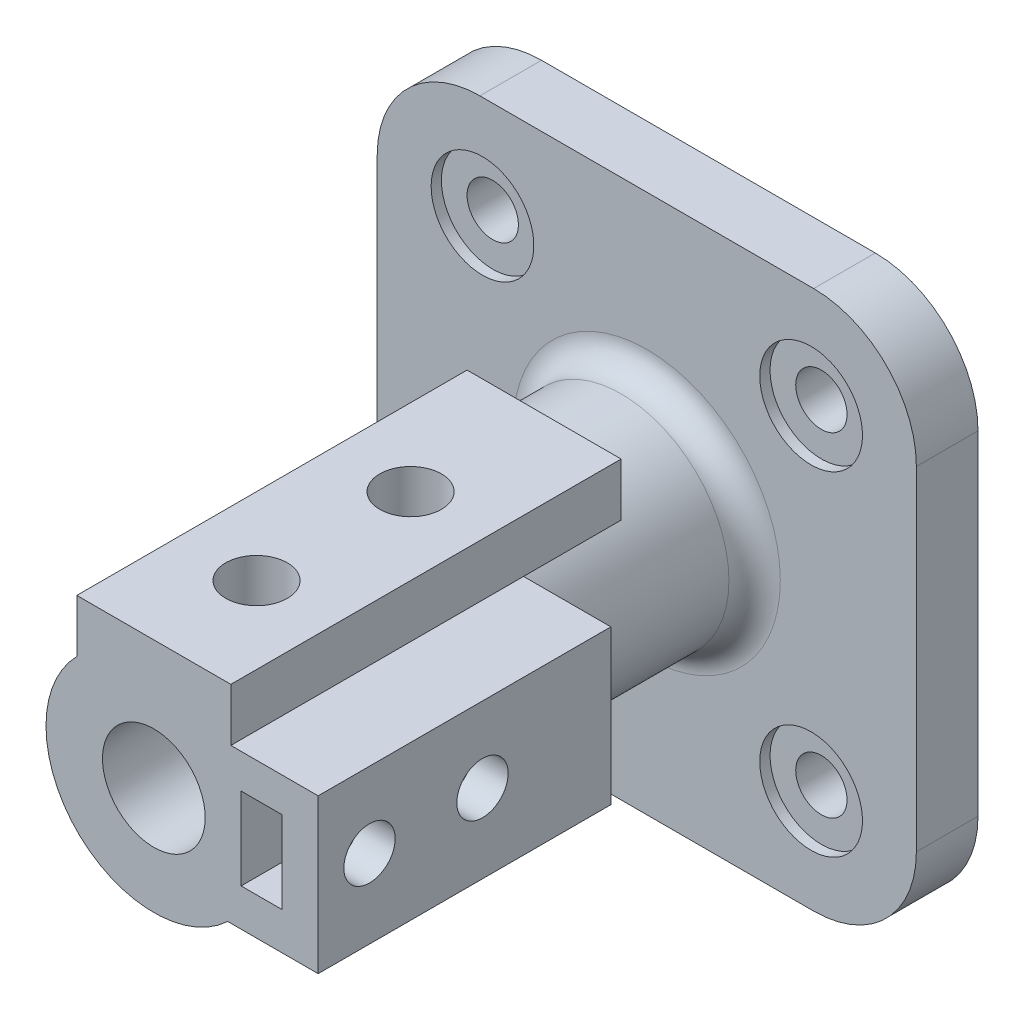
from build123d import *

# Parameters (mm, degrees)
SKETCH1_R           = 21
BOSS_EXTRUDE1_DEPTH = 48
SKETCH2_R           = 5
BOSS_EXTRUDE2_DEPTH = 12
SKETCH2_3_R         = 10
SKETCH2_3_R_2       = 5
CUT_EXTRUDE1_DEPTH  = 2
FILLET8_R           = 5
BOSS_EXTRUDE3_DEPTH = 76
BOSS_EXTRUDE4_DEPTH = 57
SKETCH4_3_W         = 8
SKETCH4_3_H         = 16
CUT_EXTRUDE2_DEPTH  = 50
SKETCH5_R           = 10
CUT_EXTRUDE3_DEPTH  = 132.059146953
CUT_EXTRUDE4_REACH  = 113.187
SKETCH6_R           = 6
CUT_EXTRUDE5_REACH  = 118.174
SKETCH7_R           = 5


with BuildPart() as part:
    # Sketch1 → Boss-Extrude1 (new, symmetric)
    with BuildSketch(Plane.XY):
        Circle(SKETCH1_R)
    extrude(amount=BOSS_EXTRUDE1_DEPTH, both=True)

    # Sketch2 → Boss-Extrude2 (add)
    with BuildSketch(Plane(origin=(0, 0, -48), x_dir=(-1, 0, 0), z_dir=(0, 0, -1))):
        with BuildLine():
            ThreePointArc((-32.5, 52.5), (-46.642135624, 46.642135624), (-52.5, 32.5))
            Line((-52.5, 32.5), (-52.5, -32.5))
            ThreePointArc((-52.5, -32.5), (-46.642135624, -46.642135624), (-32.5, -52.5))
            Line((-32.5, -52.5), (32.5, -52.5))
            ThreePointArc((32.5, -52.5), (46.642135624, -46.642135624), (52.5, -32.5))
            Line((52.5, -32.5), (52.5, 32.5))
            ThreePointArc((52.5, 32.5), (46.642135624, 46.642135624), (32.5, 52.5))
            Line((32.5, 52.5), (-32.5, 52.5))
        make_face()
        with Locations((-32, -32.5)):
            Circle(SKETCH2_R, mode=Mode.SUBTRACT)
        with Locations((-32, 32.5)):
            Circle(SKETCH2_R, mode=Mode.SUBTRACT)
        with Locations((32, -32.5)):
            Circle(SKETCH2_R, mode=Mode.SUBTRACT)
        with Locations((32, 32.5)):
            Circle(SKETCH2_R, mode=Mode.SUBTRACT)
    extrude(amount=BOSS_EXTRUDE2_DEPTH)

    # Sketch2<3> → Cut-Extrude1 (cut)
    # profile 1 of 4: a face of its own
    with BuildSketch(Plane(origin=(0, 0, -48), x_dir=(-1, 0, 0), z_dir=(0, 0, -1))):
        with Locations((-32, 32.5)):
            Circle(SKETCH2_3_R)
        with Locations((-32, 32.5)):
            Circle(SKETCH2_3_R_2, mode=Mode.SUBTRACT)
    # profile 2 of 4: a face of its own
    with BuildSketch(Plane(origin=(0, 0, -48), x_dir=(-1, 0, 0), z_dir=(0, 0, -1))):
        with Locations((-32, -32.5)):
            Circle(SKETCH2_3_R)
        with Locations((-32, -32.5)):
            Circle(SKETCH2_3_R_2, mode=Mode.SUBTRACT)
    # profile 3 of 4: a face of its own
    with BuildSketch(Plane(origin=(0, 0, -48), x_dir=(-1, 0, 0), z_dir=(0, 0, -1))):
        with Locations((32, -32.5)):
            Circle(SKETCH2_3_R)
        with Locations((32, -32.5)):
            Circle(SKETCH2_3_R_2, mode=Mode.SUBTRACT)
    # profile 4 of 4: a face of its own
    with BuildSketch(Plane(origin=(0, 0, -48), x_dir=(-1, 0, 0), z_dir=(0, 0, -1))):
        with Locations((32, 32.5)):
            Circle(SKETCH2_3_R)
        with Locations((32, 32.5)):
            Circle(SKETCH2_3_R_2, mode=Mode.SUBTRACT)
    extrude(amount=CUT_EXTRUDE1_DEPTH, mode=Mode.SUBTRACT)

    # Fillet8
    fillet8_edges = [part.edges().sort_by_distance(p)[0] for p in [
        (-21, 0, -48),
    ]]
    fillet(fillet8_edges, radius=FILLET8_R)

    # Sketch3 → Boss-Extrude3 (add)
    with BuildSketch(Plane.XY.offset(48)):
        with BuildLine():
            Line((-15, 25), (15, 25))
            Line((15, 25), (15, 14.696938457))
            ThreePointArc((15, 14.696938457), (0, 21), (-15, 14.696938457))
            Line((-15, 14.696938457), (-15, 25))
        make_face()
    extrude(amount=-BOSS_EXTRUDE3_DEPTH)

    # Sketch4 → Boss-Extrude4 (add)
    with BuildSketch(Plane.XY.offset(48)):
        with BuildLine():
            Line((32, 14.696938457), (15, 14.696938457))
            ThreePointArc((15, 14.696938457), (17.530998402, 11.561318914), (19.416487839, 8))
            Line((19.416487839, 8), (17, 8))
            Line((17, 8), (17, -8))
            Line((17, -8), (19.416487839, -8))
            ThreePointArc((19.416487839, -8), (17.288813483, -11.920441617), (14.381109394, -15.303061543))
            Line((14.381109394, -15.303061543), (32, -15.303061543))
            Line((32, -15.303061543), (32, 14.696938457))
        make_face()
    extrude(amount=-BOSS_EXTRUDE4_DEPTH)

    # Sketch4<3> → Cut-Extrude2 (cut)
    with BuildSketch(Plane.XY.offset(48)):
        with Locations((21, 0)):
            Rectangle(SKETCH4_3_W, SKETCH4_3_H)
    extrude(amount=-CUT_EXTRUDE2_DEPTH, mode=Mode.SUBTRACT)

    # Sketch5 → Cut-Extrude3 (cut, through all)
    with BuildSketch(Plane.XY.offset(48)):
        Circle(SKETCH5_R)
    extrude(amount=-CUT_EXTRUDE3_DEPTH, mode=Mode.SUBTRACT)

    # Sketch6 → Cut-Extrude4 (cut, up to next)
    with BuildSketch(Plane(origin=(0, 25, 0), x_dir=(1, 0, 0), z_dir=(0, 1, 0)), mode=Mode.PRIVATE) as cut_extrude4_sk1:
        with Locations((0, 2)):
            Circle(SKETCH6_R)
    cut_extrude4_tool1 = extrude(cut_extrude4_sk1.sketch, amount=-CUT_EXTRUDE4_REACH, mode=Mode.PRIVATE) & part.part
    # Sketch6 → Cut-Extrude4 (cut, up to next)
    with BuildSketch(Plane(origin=(0, 25, 0), x_dir=(1, 0, 0), z_dir=(0, 1, 0)), mode=Mode.PRIVATE) as cut_extrude4_sk2:
        with Locations((0, -28)):
            Circle(SKETCH6_R)
    cut_extrude4_tool2 = extrude(cut_extrude4_sk2.sketch, amount=-CUT_EXTRUDE4_REACH, mode=Mode.PRIVATE) & part.part
    add(cut_extrude4_tool1.solids().sort_by_distance((0, 25, -2))[0], mode=Mode.SUBTRACT)
    add(cut_extrude4_tool2.solids().sort_by_distance((0, 25, 28))[0], mode=Mode.SUBTRACT)

    # Sketch7 → Cut-Extrude5 (cut, up to next)
    with BuildSketch(Plane(origin=(32, 0, 0), x_dir=(0, 0, -1), z_dir=(1, 0, 0)), mode=Mode.PRIVATE) as cut_extrude5_sk1:
        with Locations((-38, 0)):
            Circle(SKETCH7_R)
    cut_extrude5_tool1 = extrude(cut_extrude5_sk1.sketch, amount=-CUT_EXTRUDE5_REACH, mode=Mode.PRIVATE) & part.part
    # Sketch7 → Cut-Extrude5 (cut, up to next)
    with BuildSketch(Plane(origin=(32, 0, 0), x_dir=(0, 0, -1), z_dir=(1, 0, 0)), mode=Mode.PRIVATE) as cut_extrude5_sk2:
        with Locations((-16, 0)):
            Circle(SKETCH7_R)
    cut_extrude5_tool2 = extrude(cut_extrude5_sk2.sketch, amount=-CUT_EXTRUDE5_REACH, mode=Mode.PRIVATE) & part.part
    add(cut_extrude5_tool1.solids().sort_by_distance((32, 0, 38))[0], mode=Mode.SUBTRACT)
    add(cut_extrude5_tool2.solids().sort_by_distance((32, 0, 16))[0], mode=Mode.SUBTRACT)


solid = part.part
